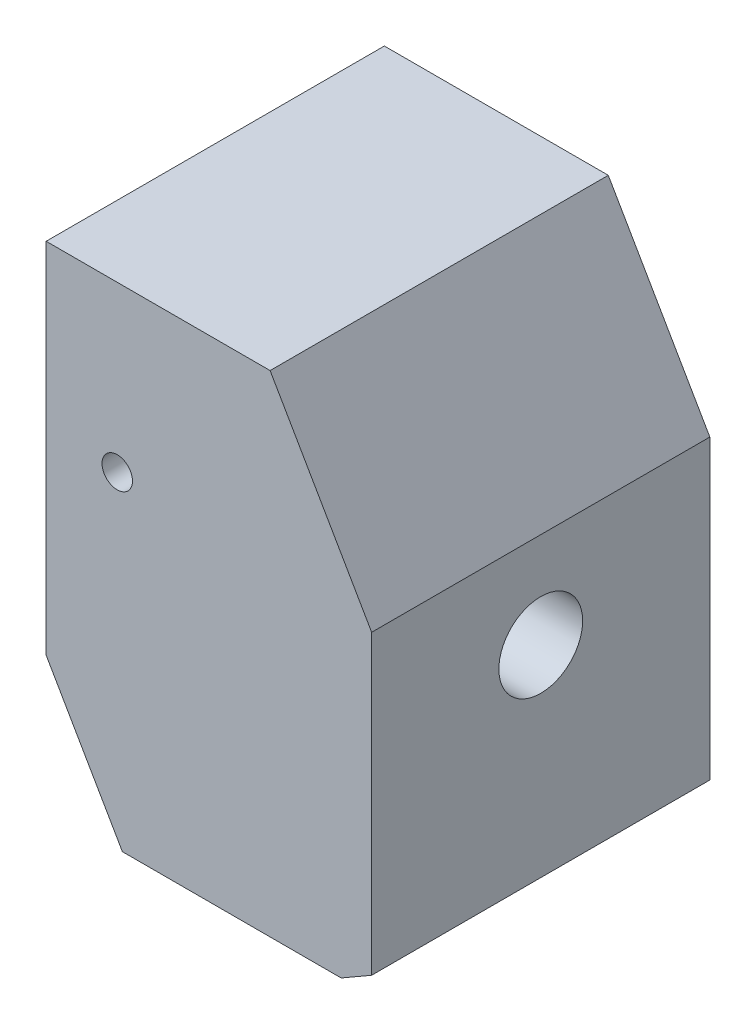
from build123d import *

# Parameters (mm, degrees)
SKETCH1_W               = 33.3
SKETCH1_H               = 48.3
BOSS_EXTRUDE1_DEPTH     = 9.55
CUT_EXTRUDE1_DEPTH      = 5
CUT_EXTRUDE2_DEPTH      = 4.5
SKETCH5_W               = 33.3
SKETCH5_H               = 48.3
BOSS_EXTRUDE3_DEPTH     = 22.5
SKETCH6_R               = 4.025
CUT_EXTRUDE3_DEPTH      = 12
SKETCH7_R               = 4.125
CUT_EXTRUDE4_DEPTH      = 15.05
CUT_EXTRUDE6_DEPTH      = 46.909857329
CUT_EXTRUDE6_DEPTH_BACK = 46.909857329
SKETCH27_R              = 1.5
SKETCH30_R              = 4
SKETCH31_R              = 5
CHAMFER1_SIZE           = 13
CHAMFER1_SIZE2          = 7.505553499
CHAMFER2_SIZE           = 10
CHAMFER2_SIZE2          = 17.320508076
CHAMFER3_SIZE           = 3
CHAMFER3_SIZE2          = 1.732050808


with BuildPart() as part:
    # Sketch1 → Boss-Extrude1 (new body)
    with BuildSketch(Plane(origin=(0, 0, 0), x_dir=(0, 0, -1), z_dir=(1, 0, 0))):
        Rectangle(SKETCH1_W, SKETCH1_H)
    extrude(amount=BOSS_EXTRUDE1_DEPTH)

    # Sketch2 → Cut-Extrude1 (cut)
    with BuildSketch(Plane.ZY):
        Polygon((0, 19.15), (-5.65, 19.15), (-5.65, 5.45), (-11.65, -0.987390776), (-11.65, -9.1), (-10.577101537, -10.1), (10.577101537, -10.1), (11.65, -9.1), (11.65, -0.987390776), (5.65, 5.45), (5.65, 11.45), (4.5, 12.6), (4.5, 19.15), align=None)
    extrude(amount=-CUT_EXTRUDE1_DEPTH, mode=Mode.SUBTRACT)

    # Sketch3 → Cut-Extrude2 (cut)
    with BuildSketch(Plane.ZY.offset(-5)):
        Polygon((-5.65, 19.15), (4.5, 19.15), (4.5, 12.6), (5.65, 11.45), (5.65, 5.45), (-5.65, 5.45), align=None)
    extrude(amount=-CUT_EXTRUDE2_DEPTH, mode=Mode.SUBTRACT)

    # Sketch5 → Boss-Extrude3 (add)
    with BuildSketch(Plane(origin=(9.55, 0, 0), x_dir=(0, 0, -1), z_dir=(1, 0, 0))):
        Rectangle(SKETCH5_W, SKETCH5_H)
    extrude(amount=BOSS_EXTRUDE3_DEPTH)

    # Sketch6 → Cut-Extrude3 (cut)
    with BuildSketch(Plane.ZY.offset(-5)):
        with Locations((0, -2.575)):
            Circle(SKETCH6_R)
    extrude(amount=-CUT_EXTRUDE3_DEPTH, mode=Mode.SUBTRACT)

    # Sketch7 → Cut-Extrude4 (cut)
    with BuildSketch(Plane.ZY.offset(-17)):
        with Locations((0, -2.575)):
            Circle(SKETCH7_R)
    extrude(amount=-CUT_EXTRUDE4_DEPTH, mode=Mode.SUBTRACT)

    # Sketch27 → Cut-Extrude6 (cut, two sides: drawn at the far end of the back side and taken through both)
    with BuildSketch(Plane(origin=(0, 0, 5.65), x_dir=(-1, 0, 0), z_dir=(0, 0, -1)).offset(-CUT_EXTRUDE6_DEPTH_BACK)):
        with Locations((-7, 7.95)):
            Circle(SKETCH27_R)
    extrude(amount=CUT_EXTRUDE6_DEPTH + CUT_EXTRUDE6_DEPTH_BACK, mode=Mode.SUBTRACT)

    # Cut-Sweep1: sweep along a path in Sketch28
    with BuildLine(Plane.XY) as cut_sweep1_path:
        Line((25.361872918, -28.011391971), (13, -6.6))
        Line((13, -6.6), (10.184139233, -1.722786085))
    # Sketch30 → Cut-Sweep1 (sweep, cut)
    with BuildSketch(Plane(origin=(18.469756751, -31.990557096, 0), x_dir=(0, 0, -1), z_dir=(0.500000000000001, -0.866025403784438, 0))):
        with Locations((0, 7.958330249)):
            Circle(SKETCH30_R)
    sweep(path=cut_sweep1_path.line, mode=Mode.SUBTRACT)

    # Cut-Sweep2: sweep along a path in Sketch29
    with BuildLine(Plane.XY) as cut_sweep2_path:
        Line((19, -16.992304845), (25.361872918, -28.011391971))
    # Sketch31 → Cut-Sweep2 (sweep, cut)
    with BuildSketch(Plane(origin=(18.469756751, -31.990557096, 0), x_dir=(0, 0, -1), z_dir=(0.500000000000001, -0.866025403784438, 0))):
        with Locations((0, 7.958330249)):
            Circle(SKETCH31_R)
    sweep(path=cut_sweep2_path.line, mode=Mode.SUBTRACT)

    # Chamfer1
    chamfer1_edges = [part.edges().sort_by_distance(p)[0] for p in [
        (0, -24.15, 0),
    ]]
    chamfer1_side = [part.faces().sort_by_distance(p)[0] for p in [
        (0, 23.563333144, 0),
    ]]
    chamfer(chamfer1_edges, length=CHAMFER1_SIZE, length2=CHAMFER1_SIZE2, reference=chamfer1_side[0])

    # Chamfer2
    chamfer2_edges = [part.edges().sort_by_distance(p)[0] for p in [
        (32.05, 24.15, 0),
    ]]
    chamfer2_side = [part.faces().sort_by_distance(p)[0] for p in [
        (16.025, 24.15, 0),
    ]]
    chamfer(chamfer2_edges, length=CHAMFER2_SIZE, length2=CHAMFER2_SIZE2, reference=chamfer2_side[0])

    # Chamfer3
    chamfer3_edges = [part.edges().sort_by_distance(p)[0] for p in [
        (32.05, -24.15, 0),
    ]]
    chamfer3_side = [part.faces().sort_by_distance(p)[0] for p in [
        (19.77777675, -24.15, -16.236318981),
    ]]
    chamfer(chamfer3_edges, length=CHAMFER3_SIZE, length2=CHAMFER3_SIZE2, reference=chamfer3_side[0])


solid = part.part
